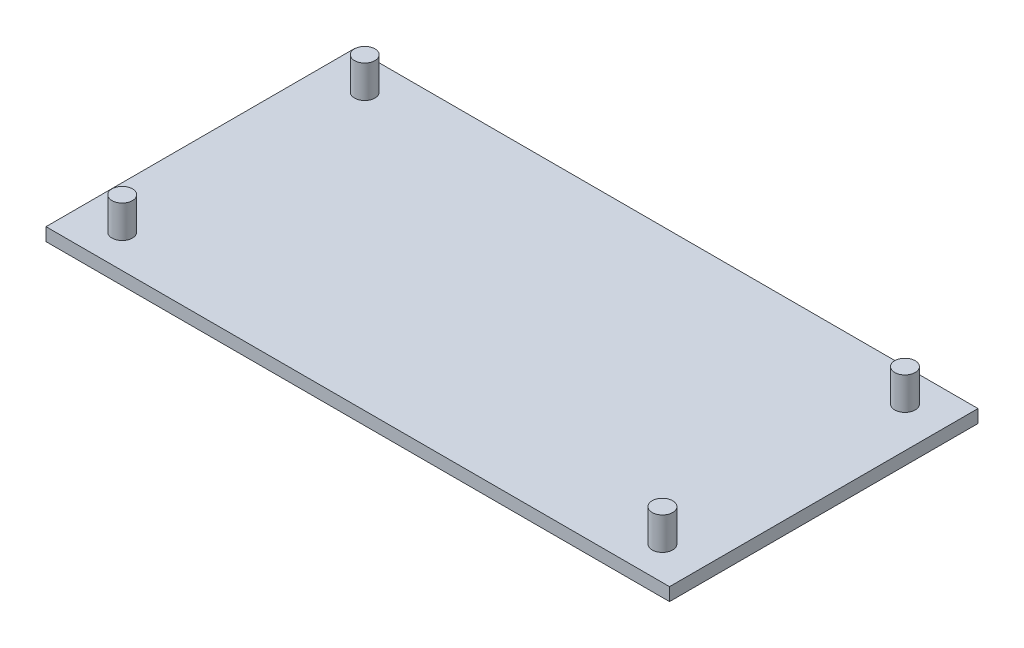
from build123d import *

# Parameters (mm, degrees)
SKETCH1_W           = 96.028964001
SKETCH1_H           = 47.509066401
BOSS_EXTRUDE1_DEPTH = 2
SKETCH2_R           = 1.575
BOSS_EXTRUDE2_DEPTH = 5


with BuildPart() as part:
    # Sketch1 → Boss-Extrude1 (new body)
    with BuildSketch(Plane(origin=(0, 0, 0), x_dir=(1, 0, 0), z_dir=(0, 1, 0))):
        with Locations((-2.136041934, 0.091893746)):
            Rectangle(SKETCH1_W, SKETCH1_H)
    extrude(amount=BOSS_EXTRUDE1_DEPTH)

    # Sketch2 → Boss-Extrude2 (add)
    with BuildSketch(Plane(origin=(0, 2, 0), x_dir=(1, 0, 0), z_dir=(0, 1, 0))):
        with Locations(Location((-43.540781796, -18.532676358, 0), (0, 0, 90))):
            Circle(SKETCH2_R)
        with Locations(Location((-43.540781796, 18.817323642, 0), (0, 0, 90))):
            Circle(SKETCH2_R)
        with Locations(Location((39.659218204, -18.532676358, 0), (0, 0, 90))):
            Circle(SKETCH2_R)
        with Locations(Location((39.659218204, 18.817323642, 0), (0, 0, 90))):
            Circle(SKETCH2_R)
    extrude(amount=BOSS_EXTRUDE2_DEPTH)


solid = part.part
